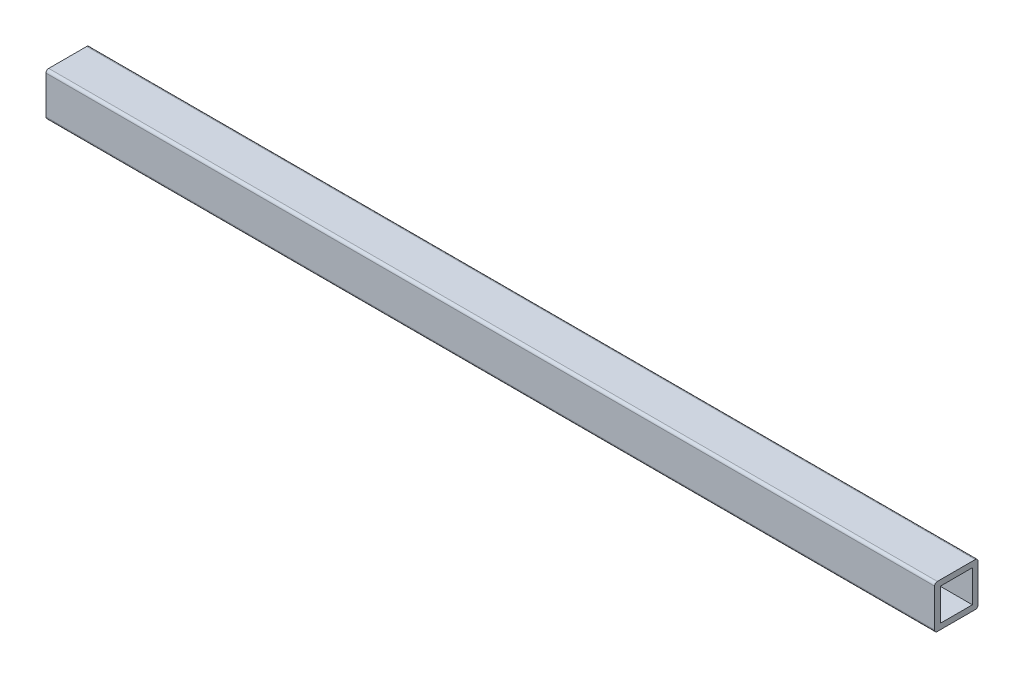
from build123d import *

# Parameters (mm, degrees)
SKETCH11_W               = 9.398
SKETCH11_H               = 9.398
STRUCTURAL_MEMBER1_DEPTH = 260.096


with BuildPart() as part:
    # Sketch11 → Structural Member1 (new body)
    with BuildSketch(Plane.YZ):
        with BuildLine():
            Line((-5.55625, 6.35), (5.55625, 6.35))
            ThreePointArc((5.55625, 6.35), (6.117516008, 6.117516008), (6.35, 5.55625))
            Line((6.35, 5.55625), (6.35, -5.55625))
            ThreePointArc((6.35, -5.55625), (6.117516008, -6.117516008), (5.55625, -6.35))
            Line((5.55625, -6.35), (-5.55625, -6.35))
            ThreePointArc((-5.55625, -6.35), (-6.117516008, -6.117516008), (-6.35, -5.55625))
            Line((-6.35, -5.55625), (-6.35, 5.55625))
            ThreePointArc((-6.35, 5.55625), (-6.117516008, 6.117516008), (-5.55625, 6.35))
        make_face()
        Rectangle(SKETCH11_W, SKETCH11_H, mode=Mode.SUBTRACT)
    extrude(amount=STRUCTURAL_MEMBER1_DEPTH)


solid = part.part
